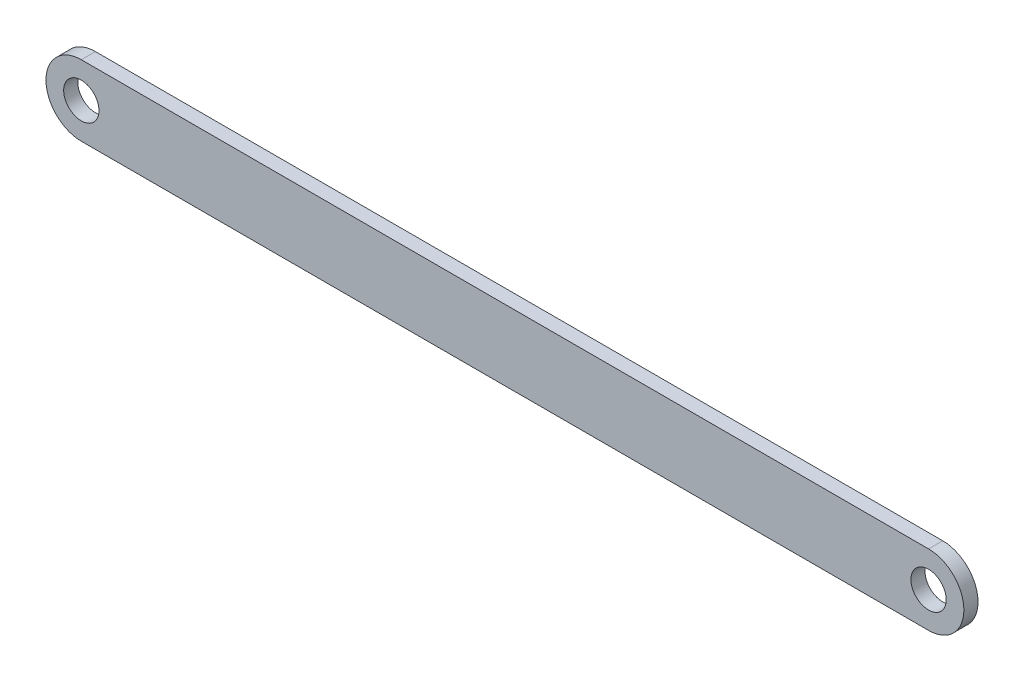
from build123d import *

# Parameters (mm, degrees)
SKETCH1_R           = 3.175
BOSS_EXTRUDE1_DEPTH = 2.54


with BuildPart() as part:
    # Sketch1 → Boss-Extrude1 (new body)
    with BuildSketch(Plane.XY):
        with BuildLine():
            Line((-76.2, 6.35), (76.2, 6.35))
            ThreePointArc((76.2, 6.35), (82.55, 0), (76.2, -6.35))
            Line((76.2, -6.35), (-76.2, -6.35))
            ThreePointArc((-76.2, -6.35), (-82.55, 0), (-76.2, 6.35))
        make_face()
        with Locations((-76.2, 0)):
            Circle(SKETCH1_R, mode=Mode.SUBTRACT)
        with Locations(Location((76.2, 0, 0), (0, 0, 180))):
            Circle(SKETCH1_R, mode=Mode.SUBTRACT)
    extrude(amount=BOSS_EXTRUDE1_DEPTH)


solid = part.part
